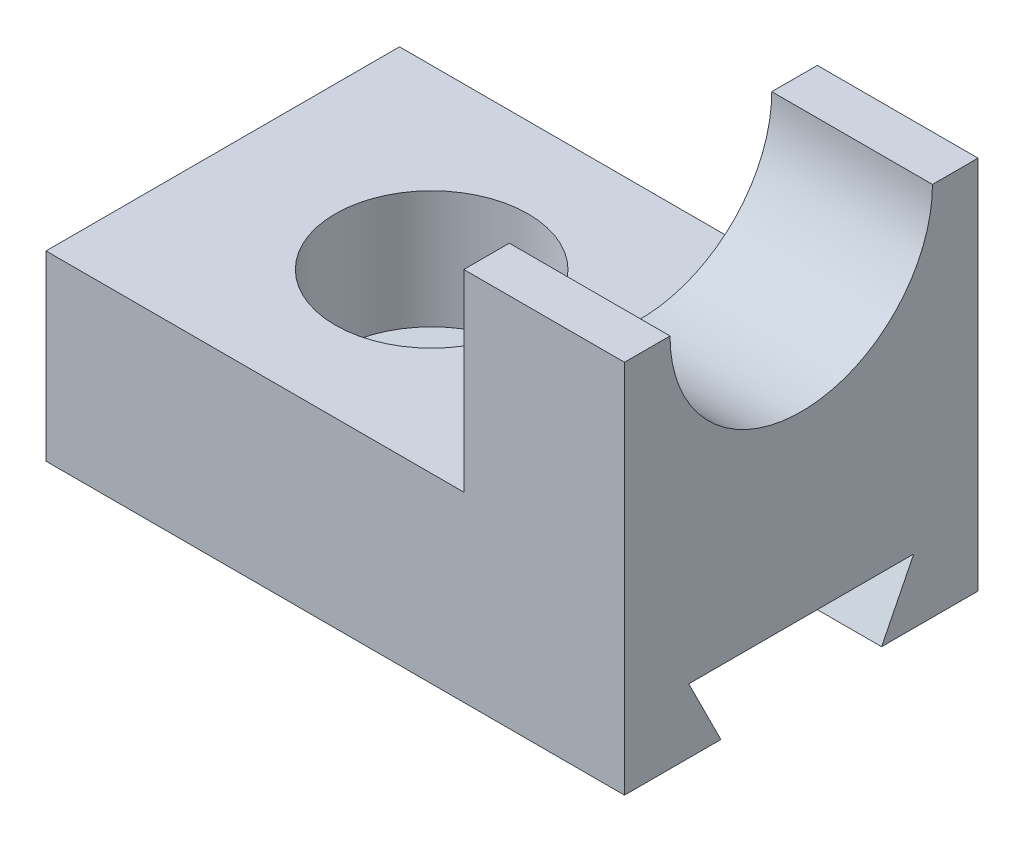
from build123d import *

# Parameters (mm, degrees)
SKETCH_1_W          = 78
SKETCH_1_H          = 66
EXTRUDE_1_DEPTH     = 34
SKETCH_1_3_W        = 30
SKETCH_1_3_H        = 66
EXTRUDE_2_DEPTH     = 70
SKETCH_2_R          = 18
CUT_EXTRUDE_1_DEPTH = 23
SKETCH_3_R          = 24.5
CUT_EXTRUDE_2_DEPTH = 70
CUT_EXTRUDE_3_REACH = 134.865


with BuildPart() as part:
    # 草图1 → 凸台-拉伸1 (new body)
    with BuildSketch(Plane(origin=(0, 0, 0), x_dir=(1, 0, 0), z_dir=(0, 1, 0))):
        with Locations((-15, 0)):
            Rectangle(SKETCH_1_W, SKETCH_1_H)
    extrude(amount=EXTRUDE_1_DEPTH)

    # 草图1<3> → 凸台-拉伸2 (add)
    with BuildSketch(Plane(origin=(0, 0, 0), x_dir=(1, 0, 0), z_dir=(0, 1, 0))):
        with Locations((39, 0)):
            Rectangle(SKETCH_1_3_W, SKETCH_1_3_H)
    extrude(amount=EXTRUDE_2_DEPTH)

    # 草图2 → 切除-拉伸1 (cut)
    with BuildSketch(Plane(origin=(0, 34, 0), x_dir=(1, 0, 0), z_dir=(0, 1, 0))):
        with Locations((-15, 0)):
            Circle(SKETCH_2_R)
    extrude(amount=-CUT_EXTRUDE_1_DEPTH, mode=Mode.SUBTRACT)

    # 草图3 → 切除-拉伸2 (cut)
    with BuildSketch(Plane.ZY.offset(-24)):
        with Locations((0, 70)):
            Circle(SKETCH_3_R)
    extrude(amount=-CUT_EXTRUDE_2_DEPTH, mode=Mode.SUBTRACT)

    # 草图4 → 切除-拉伸3 (cut, up to next)
    with BuildSketch(Plane.ZY.offset(54), mode=Mode.PRIVATE) as cut_extrude_3_sk1:
        Polygon((21, 12), (-21, 12), (-15, 0), (15, 0), align=None)
    cut_extrude_3_tool1 = extrude(cut_extrude_3_sk1.sketch, amount=-CUT_EXTRUDE_3_REACH, mode=Mode.PRIVATE) & part.part
    add(cut_extrude_3_tool1.solids().sort_by_distance((-54, 6.333333, 0))[0], mode=Mode.SUBTRACT)


solid = part.part
